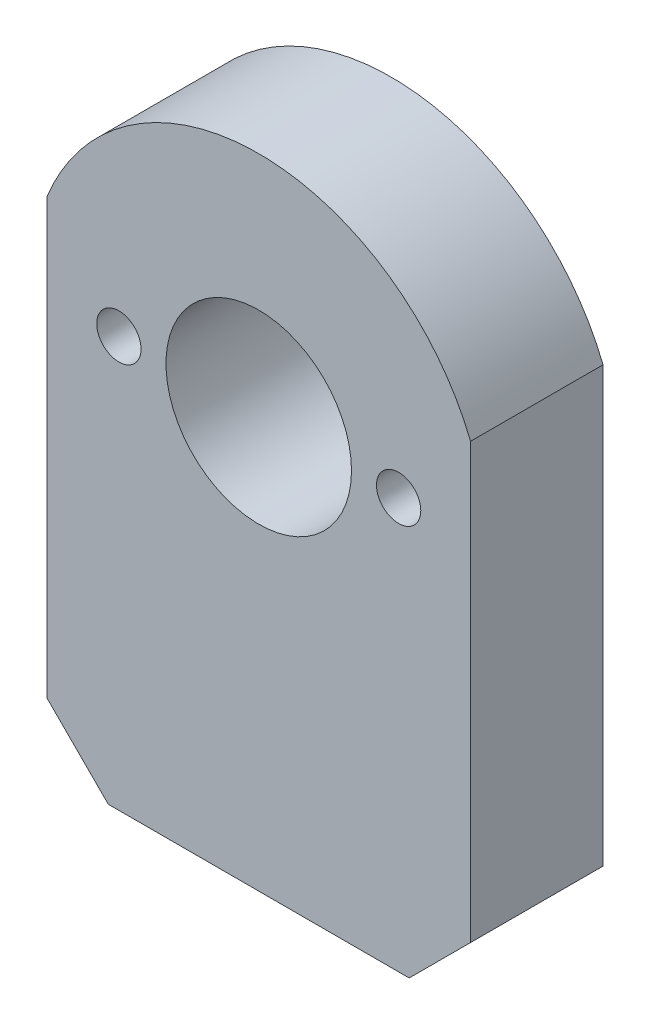
from build123d import *

# Parameters (mm, degrees)
SKETCH1_R           = 6.3
BOSS_EXTRUDE1_DEPTH = 9
SKETCH2_R           = 1.505
CUT_EXTRUDE1_DEPTH  = 9


with BuildPart() as part:
    # Sketch1 → Boss-Extrude1 (new body)
    with BuildSketch(Plane.XY):
        with BuildLine():
            Line((0, 0), (20.437665022, 0))
            Line((20.437665022, 0), (24.603832511, 4.166167489))
            Line((24.603832511, 4.166167489), (24.603832511, 33.652501624))
            ThreePointArc((24.603832511, 33.652501624), (10.218832511, 43.38), (-4.166167489, 33.652501624))
            Line((-4.166167489, 33.652501624), (-4.166167489, 4.166167489))
            Line((-4.166167489, 4.166167489), (0, 0))
        make_face()
        with Locations((10.218832511, 27.88)):
            Circle(SKETCH1_R, mode=Mode.SUBTRACT)
    extrude(amount=BOSS_EXTRUDE1_DEPTH)

    # Sketch2 → Cut-Extrude1 (cut)
    with BuildSketch(Plane.XY.offset(9)):
        with Locations((0.718832511, 27.88)):
            Circle(SKETCH2_R)
        with Locations((19.718832511, 27.88)):
            Circle(SKETCH2_R)
    extrude(amount=-CUT_EXTRUDE1_DEPTH, mode=Mode.SUBTRACT)


solid = part.part
